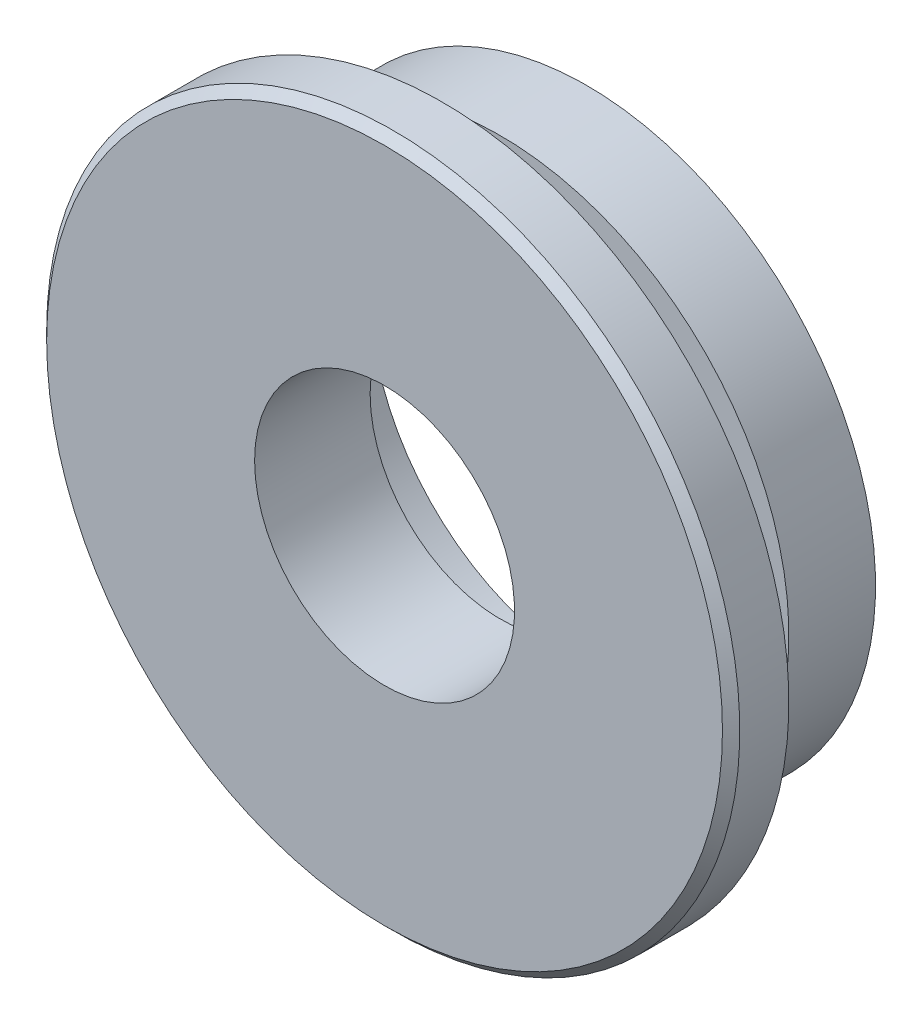
from build123d import *


with BuildPart() as part:
    # Эскиз2 → Повернуть1 (revolve)
    with BuildSketch(Plane(origin=(0, 0, 0), x_dir=(1, 0, 0), z_dir=(0, 1, 0))):
        Polygon((-4.5, 0), (-11.7, 0), (-12, 0.3), (-12, 2), (-9, 2), (-9, 4), (-10, 4), (-10, 7), (-7.5, 7), (-7.5, 4), (-4.5, 4), align=None)
    revolve(axis=Axis((0, 0, -7), (0, 0, 1)))


solid = part.part
